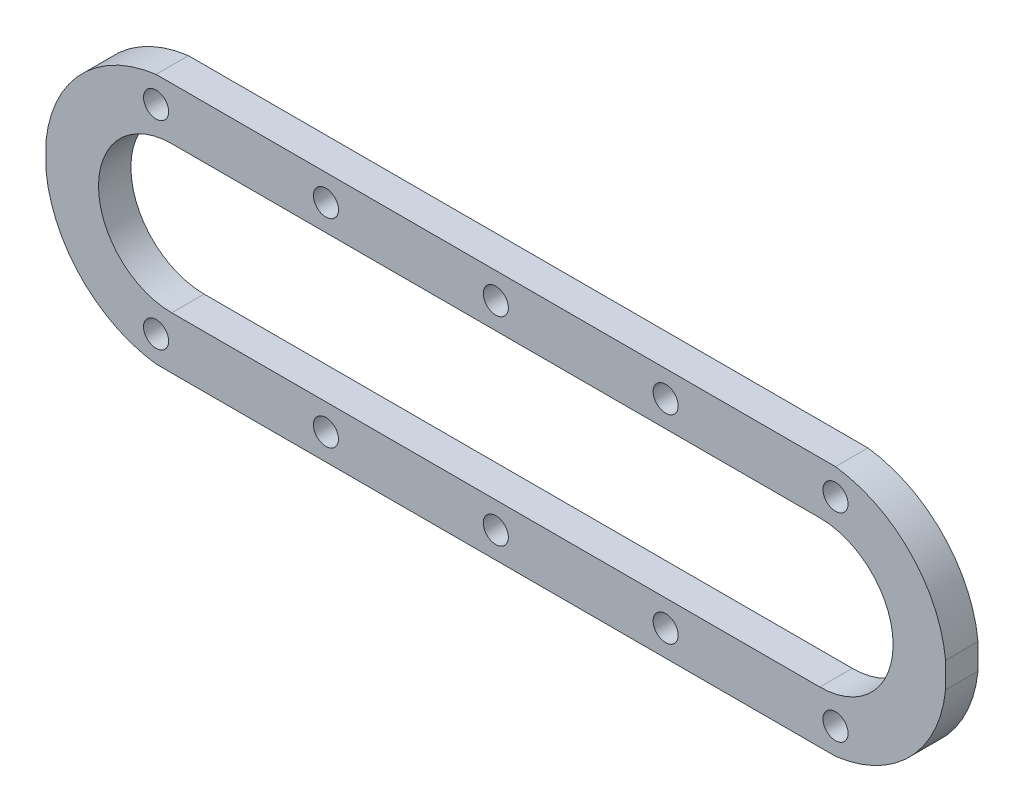
from build123d import *

# Parameters (mm, degrees)
SKETCH1_W                    = 176.276
SKETCH1_H                    = 49.149
BOSS_EXTRUDE1_DEPTH          = 6.35
CUT_EXTRUDE1_DEPTH           = 92.719875677
CUT_EXTRUDE4_DEPTH           = 92.719875677
F_10_0_1935_DIAMETER_HOLE1_D = 4.9149


with BuildPart() as part:
    # Sketch1 → Boss-Extrude1 (new body)
    with BuildSketch(Plane.XY):
        Rectangle(SKETCH1_W, SKETCH1_H)
    extrude(amount=BOSS_EXTRUDE1_DEPTH)

    # Sketch2 → Cut-Extrude1 (cut, through all)
    with BuildSketch(Plane.XY.offset(6.35)):
        with BuildLine():
            Line((63.5, -14.351), (-63.5, -14.351))
            ThreePointArc((-63.5, -14.351), (-77.851, 0), (-63.5, 14.351))
            Line((-63.5, 14.351), (63.5, 14.351))
            ThreePointArc((63.5, 14.351), (77.851, 0), (63.5, -14.351))
        make_face()
    extrude(amount=-CUT_EXTRUDE1_DEPTH, mode=Mode.SUBTRACT)

    # Sketch8 → Cut-Extrude4 (cut, through all)
    with BuildSketch(Plane.XY.offset(6.35)):
        with BuildLine():
            ThreePointArc((-88.138, 2.504831531), (-81.209963357, 17.310760321), (-66.565807357, 24.5745))
            Line((-66.565807357, 24.5745), (-88.138, 24.5745))
            Line((-88.138, 24.5745), (-88.138, 2.504831531))
        make_face()
        with BuildLine():
            ThreePointArc((-66.565807357, -24.5745), (-81.209963357, -17.310760321), (-88.138, -2.504831531))
            Line((-88.138, -2.504831531), (-88.138, -24.5745))
            Line((-88.138, -24.5745), (-66.565807357, -24.5745))
        make_face()
        with BuildLine():
            Line((88.138, 24.5745), (66.565807357, 24.5745))
            ThreePointArc((66.565807357, 24.5745), (81.209963357, 17.310760321), (88.138, 2.504831531))
            Line((88.138, 2.504831531), (88.138, 24.5745))
        make_face()
        with BuildLine():
            Line((88.138, -24.5745), (88.138, -2.504831531))
            ThreePointArc((88.138, -2.504831531), (81.209963357, -17.310760321), (66.565807357, -24.5745))
            Line((66.565807357, -24.5745), (88.138, -24.5745))
        make_face()
    extrude(amount=-CUT_EXTRUDE4_DEPTH, mode=Mode.SUBTRACT)

    # #10 (0.1935) Diameter Hole1 (through all)
    with Locations(Plane.XY.offset(6.35)):
        with Locations((-66.565807357, 19.46275), (-33.282903678, 19.46275), (0, 19.46275), (33.282903678, 19.46275), (66.565807357, 19.46275), (66.565807357, -19.46275), (33.282903678, -19.46275), (0, -19.46275), (-33.282903678, -19.46275), (-66.565807357, -19.46275)):
            Hole(F_10_0_1935_DIAMETER_HOLE1_D / 2)


solid = part.part
